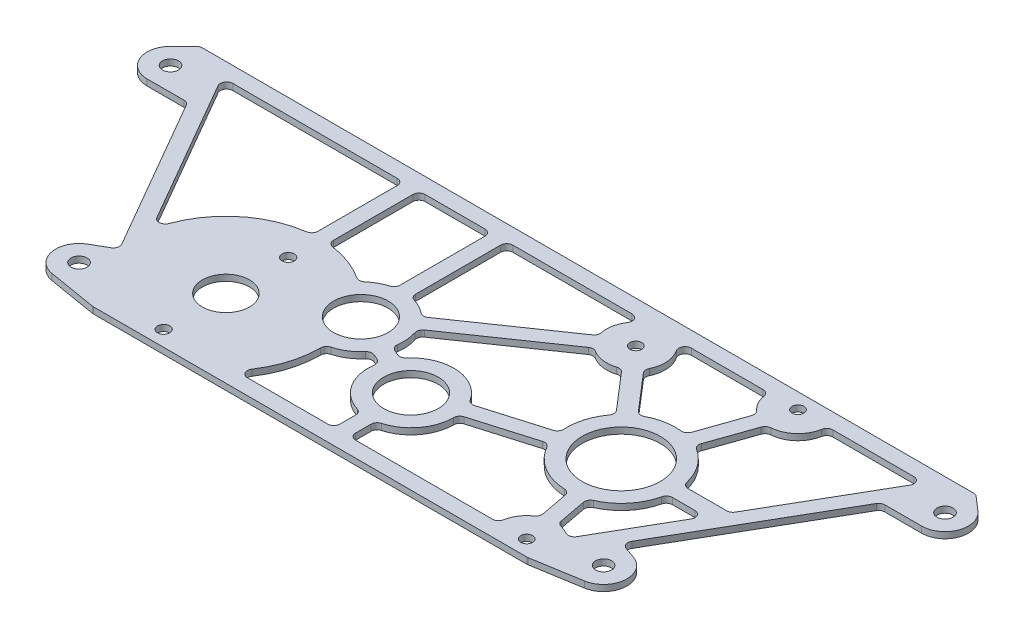
from build123d import *

# Parameters (mm, degrees)
SKETCH1_R           = 3.2639
SKETCH1_R_2         = 2.413
SKETCH1_R_3         = 15.9512
SKETCH1_R_4         = 2.4892
SKETCH1_R_5         = 9.6012
SKETCH1_R_6         = 11.1252
BOSS_EXTRUDE1_DEPTH = 2.54
CUT_EXTRUDE2_DEPTH  = 222.448660848
FILLET1_R           = 2.54


with BuildPart() as part:
    # Sketch1 → Boss-Extrude1 (new body)
    with BuildSketch(Plane(origin=(0, 0, 0), x_dir=(1, 0, 0), z_dir=(0, 1, 0))):
        Polygon((82.765168987, 84.29625), (-155.087712155, 84.29625), (-89.463193808, -29.36875), (139.136806192, -29.36875), (204.76132454, 84.29625), align=None)
        with Locations((-82.130845389, -16.66875)):
            Circle(SKETCH1_R, mode=Mode.SUBTRACT)
        with Locations((106.801238666, -23.01875)):
            Circle(SKETCH1_R_2, mode=Mode.SUBTRACT)
        with Locations((131.804457774, -16.66875)):
            Circle(SKETCH1_R, mode=Mode.SUBTRACT)
        with Locations((97.785549043, 24.534144815)):
            Circle(SKETCH1_R_3, mode=Mode.SUBTRACT)
        with Locations((-133.090666899, 71.59625)):
            Circle(SKETCH1_R, mode=Mode.SUBTRACT)
        with Locations((60.863233747, 67.406835627)):
            Circle(SKETCH1_R_2, mode=Mode.SUBTRACT)
        with Locations((116.452953896, 77.94625)):
            Circle(SKETCH1_R_2, mode=Mode.SUBTRACT)
        with Locations((182.764279284, 71.59625)):
            Circle(SKETCH1_R, mode=Mode.SUBTRACT)
        with Locations((-41.275, -23.01875)):
            Circle(SKETCH1_R_4, mode=Mode.SUBTRACT)
        with Locations((-41.275, 2.38125)):
            Circle(SKETCH1_R_5, mode=Mode.SUBTRACT)
        with Locations((-41.275, 27.78125)):
            Circle(SKETCH1_R_4, mode=Mode.SUBTRACT)
        with Locations((-5.496024757, 21.654924548)):
            Circle(SKETCH1_R_6, mode=Mode.SUBTRACT)
        with Locations((31.5722, 4.994903139)):
            Circle(SKETCH1_R_6, mode=Mode.SUBTRACT)
    extrude(amount=BOSS_EXTRUDE1_DEPTH)

    # Sketch3 → Cut-Extrude2 (cut, through all)
    with BuildSketch(Plane(origin=(0, 2.54, 0), x_dir=(1, 0, 0), z_dir=(0, 1, 0))):
        with BuildLine():
            ThreePointArc((-133.090666899, 62.07125), (-141.890619446, 67.951190307), (-139.82585899, 78.331442091))
            Line((-139.82585899, 78.331442091), (-133.861051081, 84.29625))
            Line((-133.861051081, 84.29625), (-155.087712155, 84.29625))
            Line((-155.087712155, 84.29625), (-89.463193808, -29.36875))
            Line((-89.463193808, -29.36875), (-63.799974342, -29.36875))
            Line((-63.799974342, -29.36875), (-83.691446573, -26.065033784))
            ThreePointArc((-83.691446573, -26.065033784), (-91.50279604, -18.36938694), (-86.893345389, -8.419858029))
            Line((-86.893345389, -8.419858029), (-78.644453418, -3.657358029))
            Line((-78.644453418, -3.657358029), (-116.592882957, 62.07125))
            Line((-116.592882957, 62.07125), (-133.090666899, 62.07125))
        make_face()
        with BuildLine():
            Line((204.76132454, 84.29625), (182.649260278, 84.29625))
            Line((182.649260278, 84.29625), (188.999855497, 78.796473211))
            ThreePointArc((188.999855497, 78.796473211), (191.689181274, 68.268826153), (182.764279284, 62.07125))
            Line((182.764279284, 62.07125), (166.266495341, 62.07125))
            Line((166.266495341, 62.07125), (127.500995347, -5.072565572))
            Line((127.500995347, -5.072565572), (134.949342342, -7.677903207))
            ThreePointArc((134.949342342, -7.677903207), (141.294296642, -17.486419401), (133.365058957, -26.065033784))
            Line((133.365058957, -26.065033784), (113.473586727, -29.36875))
            Line((113.473586727, -29.36875), (139.136806192, -29.36875))
            Line((139.136806192, -29.36875), (204.76132454, 84.29625))
        make_face()
        with BuildLine():
            Line((139.095176244, 27.709144815), (168.099582446, 77.94625))
            Line((168.099582446, 77.94625), (128.390953896, 77.94625))
            ThreePointArc((128.390953896, 77.94625), (124.606791303, 69.226686964), (115.653346334, 66.03505897))
            Line((115.653346334, 66.03505897), (108.040207809, 44.251969202))
            ThreePointArc((108.040207809, 44.251969202), (115.908996915, 37.398485537), (119.782594299, 27.709144815))
            Line((119.782594299, 27.709144815), (139.095176244, 27.709144815))
        make_face()
        with BuildLine():
            Line((-44.45, 77.94625), (-118.425970062, 77.94625))
            Line((-118.425970062, 77.94625), (-79.104121802, 9.838810966))
            ThreePointArc((-79.104121802, 9.838810966), (-66.967401569, 31.131174756), (-44.45, 40.807504655))
            Line((-44.45, 40.807504655), (-44.45, 77.94625))
        make_face()
        with BuildLine():
            Line((104.514953896, 77.94625), (66.470067852, 77.94625))
            ThreePointArc((66.470067852, 77.94625), (72.442916159, 70.309730602), (70.778789526, 60.758708251))
            Line((70.778789526, 60.758708251), (85.83683874, 43.273913946))
            ThreePointArc((85.83683874, 43.273913946), (93.645596936, 46.370156849), (102.045768896, 46.347011472))
            Line((102.045768896, 46.347011472), (109.65890742, 68.13010124))
            ThreePointArc((109.65890742, 68.13010124), (105.878854151, 72.405107646), (104.514953896, 77.94625))
        make_face()
        with BuildLine():
            ThreePointArc((-2.771017966, 4.40635231), (-4.839844683, -10.233706554), (-12.26642072, -23.01875))
            Line((-12.26642072, -23.01875), (28.129339189, -23.01875))
            Line((28.129339189, -23.01875), (28.129339189, -12.124840307))
            ThreePointArc((28.129339189, -12.124840307), (16.836600763, -4.375316783), (14.608364142, 9.138232624))
            Line((14.608364142, 9.138232624), (8.864682756, 11.719684945))
            ThreePointArc((8.864682756, 11.719684945), (3.796532312, 6.870226737), (-2.771017966, 4.40635231))
        make_face()
        with BuildLine():
            Line((-8.671024757, 77.94625), (-38.1, 77.94625))
            Line((-38.1, 77.94625), (-38.1, 40.807504655))
            ThreePointArc((-38.1, 40.807504655), (-27.736533159, 38.483432585), (-18.400321213, 33.420044149))
            ThreePointArc((-18.400321213, 33.420044149), (-13.977947484, 36.919127544), (-8.671024757, 38.826362497))
            Line((-8.671024757, 38.826362497), (-8.671024757, 77.94625))
        make_face()
        with BuildLine():
            Line((55.256399643, 77.94625), (-2.321024757, 77.94625))
            Line((-2.321024757, 77.94625), (-2.321024757, 38.826362497))
            ThreePointArc((-2.321024757, 38.826362497), (2.623353726, 37.11502155), (6.838823629, 34.015766814))
            Line((6.838823629, 34.015766814), (49.586583429, 63.48854498))
            ThreePointArc((49.586583429, 63.48854498), (49.74930914, 71.765335808), (55.256399643, 77.94625))
        make_face()
        with BuildLine():
            Line((53.190988553, 58.26066169), (10.443228754, 28.787883524))
            ThreePointArc((10.443228754, 28.787883524), (11.894834706, 23.235086999), (11.467811101, 17.511595064))
            Line((11.467811101, 17.511595064), (17.211492487, 14.930142742))
            ThreePointArc((17.211492487, 14.930142742), (32.75384782, 22.417377553), (47.142902783, 12.900098968))
            Line((47.142902783, 12.900098968), (75.789316642, 21.35351828))
            ThreePointArc((75.789316642, 21.35351828), (76.466089858, 30.813578312), (81.025237976, 39.130123642))
            Line((81.025237976, 39.130123642), (65.967188761, 56.614917947))
            ThreePointArc((65.967188761, 56.614917947), (59.338062698, 55.566662602), (53.190988553, 58.26066169))
        make_face()
        with BuildLine():
            ThreePointArc((98.76360869, 2.330676069), (86.202224566, 5.566350555), (77.586551721, 15.26316147))
            Line((77.586551721, 15.26316147), (48.940137862, 6.809742158))
            ThreePointArc((48.940137862, 6.809742158), (45.476862687, -5.569152039), (34.479339189, -12.223907737))
            Line((34.479339189, -12.223907737), (34.479339189, -23.01875))
            Line((34.479339189, -23.01875), (95.107688433, -23.01875))
            ThreePointArc((95.107688433, -23.01875), (96.858138144, -16.864575071), (101.585425014, -12.552881426))
            Line((101.585425014, -12.552881426), (98.76360869, 2.330676069))
        make_face()
        with BuildLine():
            ThreePointArc((119.782594299, 21.359144815), (114.902223086, 10.357752654), (105.002469271, 3.513519529))
            Line((105.002469271, 3.513519529), (107.824285596, -11.370037967))
            ThreePointArc((107.824285596, -11.370037967), (111.546534886, -12.331314347), (114.755897698, -14.447722247))
            Line((114.755897698, -14.447722247), (135.429002035, 21.359144815))
            Line((135.429002035, 21.359144815), (119.782594299, 21.359144815))
        make_face()
    extrude(amount=-CUT_EXTRUDE2_DEPTH, mode=Mode.SUBTRACT)

    # Fillet1
    fillet1_edges = [part.edges().sort_by_distance(p)[0] for p in [
        (127.500995347, 1.27, 5.072565572),
        (182.649260278, 1.27, -84.29625),
        (166.266495341, 1.27, -62.07125),
        (11.467811101, 1.27, -17.511595064),
        (10.443228754, 1.27, -28.787883524),
        (102.045768896, 1.27, -46.347011472),
        (107.824285596, 1.27, 11.370037967),
        (34.479339189, 1.27, 12.223907737),
        (108.040207809, 1.27, -44.251969202),
        (85.83683874, 1.27, -43.273913946),
        (65.967188761, 1.27, -56.614917947),
        (53.190988553, 1.27, -58.26066169),
        (6.838823629, 1.27, -34.015766814),
        (-2.321024757, 1.27, -38.826362497),
        (-18.400321213, 1.27, -33.420044149),
        (-38.1, 1.27, -40.807504655),
        (-2.321024757, 1.27, -77.94625),
        (-38.1, 1.27, -77.94625),
        (66.470067852, 1.27, -77.94625),
        (70.778789526, 1.27, -60.758708251),
        (115.653346334, 1.27, -66.03505897),
        (128.390953896, 1.27, -77.94625),
        (-118.425970062, 1.27, -77.94625),
        (139.095176244, 1.27, -27.709144815),
        (119.782594299, 1.27, -27.709144815),
        (17.211492487, 1.27, -14.930142742),
        (-79.104121802, 1.27, -9.838810966),
        (-12.26642072, 1.27, 23.01875),
        (-2.771017966, 1.27, -4.40635231),
        (8.864682756, 1.27, -11.719684945),
        (48.940137862, 1.27, -6.809742158),
        (47.142902783, 1.27, -12.900098968),
        (77.586551721, 1.27, -15.26316147),
        (105.002469271, 1.27, -3.513519529),
        (98.76360869, 1.27, -2.330676069),
        (119.782594299, 1.27, -21.359144815),
        (114.755897698, 1.27, 14.447722247),
        (101.585425014, 1.27, 12.552881426),
        (95.107688433, 1.27, 23.01875),
        (113.473586727, 1.27, 29.36875),
        (-63.799974342, 1.27, 29.36875),
        (-78.644453418, 1.27, 3.657358029),
        (34.479339189, 1.27, 23.01875),
        (28.129339189, 1.27, 23.01875),
        (28.129339189, 1.27, 12.124840307),
        (14.608364142, 1.27, -9.138232624),
        (75.789316642, 1.27, -21.35351828),
        (135.429002035, 1.27, -21.359144815),
        (168.099582446, 1.27, -77.94625),
        (109.65890742, 1.27, -68.13010124),
        (104.514953896, 1.27, -77.94625),
        (81.025237976, 1.27, -39.130123642),
        (49.586583429, 1.27, -63.48854498),
        (55.256399643, 1.27, -77.94625),
        (-8.671024757, 1.27, -38.826362497),
        (-44.45, 1.27, -40.807504655),
        (-8.671024757, 1.27, -77.94625),
        (-44.45, 1.27, -77.94625),
        (-133.861051081, 1.27, -84.29625),
        (-116.592882957, 1.27, -62.07125),
    ]]
    fillet(fillet1_edges, radius=FILLET1_R)


solid = part.part
